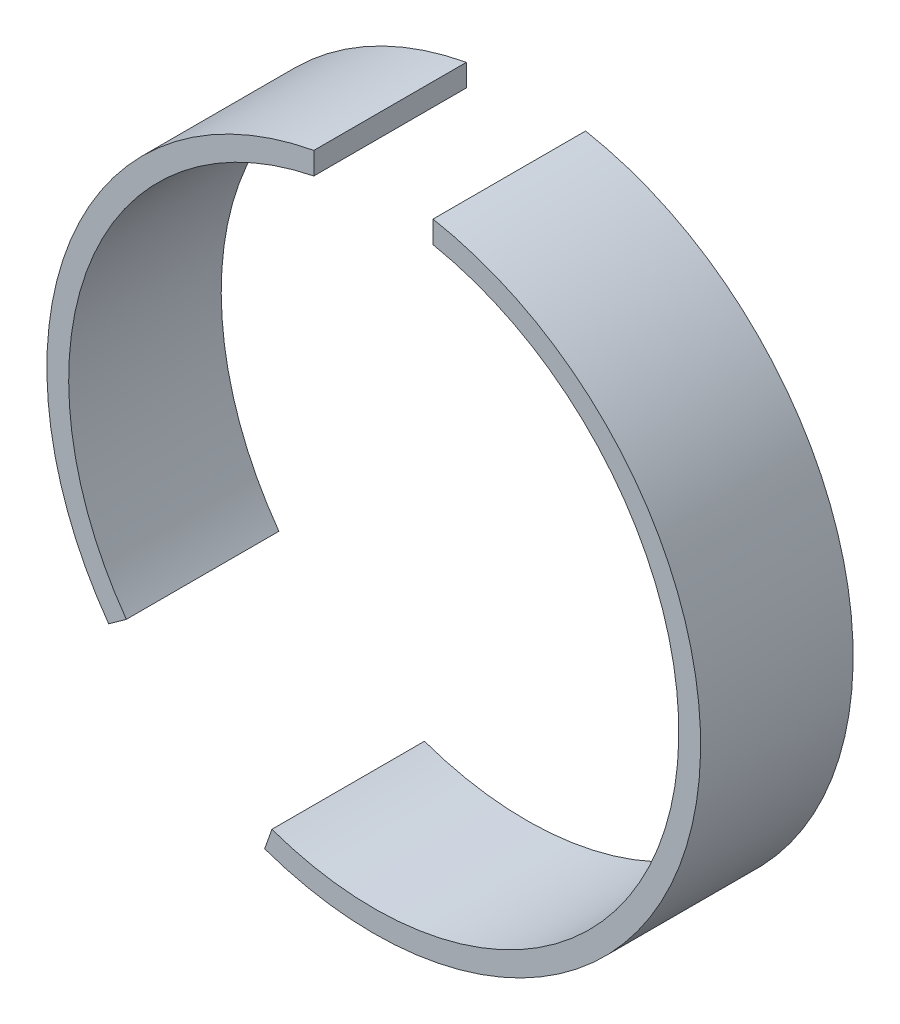
from build123d import *

# Parameters (mm, degrees)
BOSS_EXTRUDE2_DEPTH   = 14
BOSS_EXTRUDE2_2_DEPTH = 14


with BuildPart() as part:
    # Sketch2 → Boss-Extrude2 (new body)
    with BuildSketch(Plane.XY):
        with BuildLine():
            Line((-9.346378644, -26.394037324), (-10.013977119, -28.279325704))
            ThreePointArc((-10.013977119, -28.279325704), (28.981369773, -7.751142245), (5.439963605, 29.502657439))
            Line((5.439963605, 29.502657439), (5.439963605, 27.466466755))
            ThreePointArc((5.439963605, 27.466466755), (27.000990621, -7.412591011), (-9.346378644, -26.394037324))
        make_face()
    extrude(amount=BOSS_EXTRUDE2_DEPTH)


with BuildPart() as body_2:
    # Sketch2 → Boss-Extrude2 2 (new body)
    with BuildSketch(Plane.XY):
        with BuildLine():
            Line((-24.326216711, -17.556627824), (-22.70446893, -16.386185969))
            ThreePointArc((-22.70446893, -16.386185969), (-26.064815845, 10.228654603), (-5.5, 27.454507827))
            Line((-5.5, 27.454507827), (-5.5, 29.491524206))
            ThreePointArc((-5.5, 29.491524206), (-27.852880518, 11.145270155), (-24.326216711, -17.556627824))
        make_face()
    extrude(amount=BOSS_EXTRUDE2_2_DEPTH)


solid = Compound([part.part, body_2.part])
